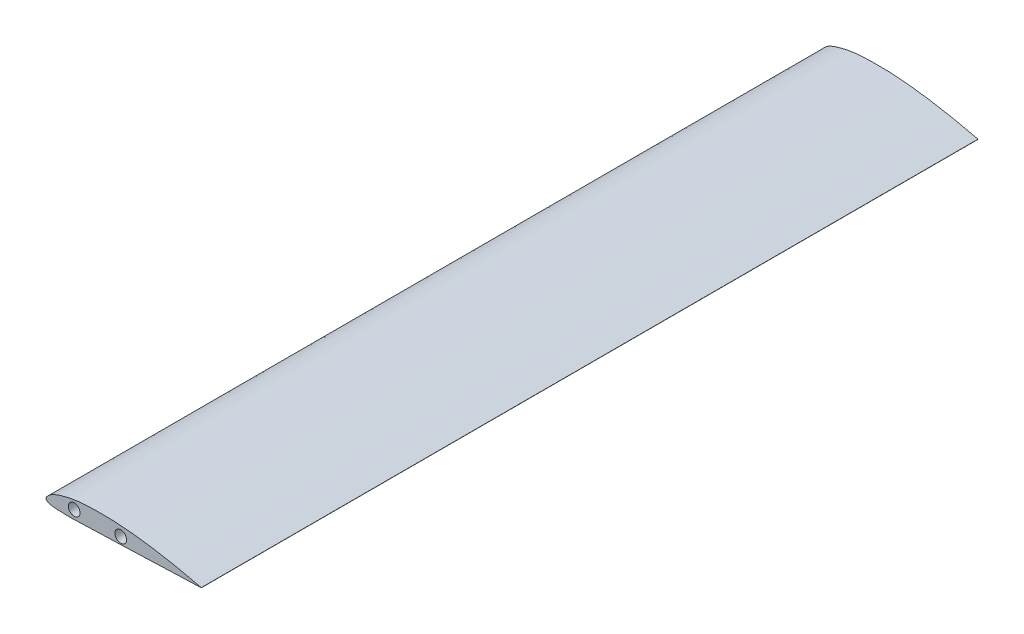
from build123d import *

# Parameters (mm, degrees)
BOSS_EXTRUDE1_DEPTH = 254
SKETCH2_R           = 1.905
CUT_EXTRUDE1_DEPTH  = 12.7


with BuildPart() as part:
    # Sketch1 → Boss-Extrude1 (new body)
    with BuildSketch(Plane.XY):
        with BuildLine():
            Line((50.8, 0.0304292), (50.8, -0.0304292))
            add(Edge.make_bspline(
                [(50.8, 0.0304292), (50.63067102, 0.070579584), (50.29203583, 0.150874953), (49.784053923, 0.270975499), (49.276103861, 0.3906376), (48.598975978, 0.548855774), (47.752607871, 0.743726876), (46.736570106, 0.971867714), (45.720515706, 1.194603662), (44.70452705, 1.412442044), (43.688526366, 1.625048045), (42.672544186, 1.83238449), (41.656522264, 2.034024033), (40.640545517, 2.23021224), (39.624516645, 2.420357812), (38.608526857, 2.604792252), (37.59249485, 2.783050048), (36.576495895, 2.955471006), (35.560483387, 3.121740236), (34.544495834, 3.281876565), (33.528530885, 3.435493939), (32.512531352, 3.581686893), (31.496553083, 3.720222443), (30.480541121, 3.850178133), (29.126506483, 4.011498541), (27.771719898, 4.154664361), (26.416397421, 4.279557315), (25.400362172, 4.364059043), (24.384339054, 4.439344114), (23.030041724, 4.526642184), (21.675232888, 4.592491037), (20.320155782, 4.633691392), (19.30406966, 4.651334264), (18.287997053, 4.656566857), (17.271942664, 4.650307427), (16.255901326, 4.633837814), (15.239876724, 4.607821863), (14.223762431, 4.574113992), (13.207547014, 4.528270701), (12.191199646, 4.465450912), (11.17469825, 4.38044787), (10.157997005, 4.268357118), (9.141444229, 4.123426341), (8.125037117, 3.945345186), (7.108348174, 3.735375641), (6.091035966, 3.491394576), (5.07322112, 3.206513965), (4.05555575, 2.871950094), (3.208501887, 2.55234561), (2.533415643, 2.251664373), (2.021814974, 1.989758164), (1.505610587, 1.678572801), (1.029061746, 1.315449955), (0.671173287, 0.970843301), (0.397988148, 0.693865537), (0.224504552, 0.491374229), (0.110424089, 0.317101829), (0.05462197, 0.202939449), (0.018976012, 0.104583867), (-0.013292311, -0.037523946), (0.003121477, -0.18539933), (0.054578612, -0.314116806), (0.109862255, -0.41647484), (0.222129251, -0.56568907), (0.393319806, -0.723830258), (0.660323781, -0.904551123), (1.039214509, -1.050937114), (1.522549872, -1.148317492), (2.030189933, -1.249261735), (2.538556158, -1.326845098), (3.215971307, -1.398672831), (4.063574062, -1.447382771), (5.07964625, -1.495649751), (6.09584327, -1.524658827), (7.111951661, -1.538414328), (8.128029402, -1.538832774), (9.144067551, -1.527977449), (10.498852085, -1.501587878), (11.8534935, -1.461324533), (13.20804034, -1.413414637), (14.22401573, -1.375300098), (15.23998867, -1.336317497), (16.255986169, -1.298109955), (17.271994177, -1.26071418), (18.287994793, -1.22356128), (19.304001357, -1.186759222), (20.320002845, -1.149834522), (21.336002667, -1.112745329), (22.352003187, -1.07552275), (23.367999482, -1.038083922), (24.38400137, -1.000729471), (25.399998775, -0.963253257), (26.415999174, -0.925875262), (27.431998934, -0.888530703), (29.125333833, -0.826411065), (30.818666122, -0.764237314), (32.8506686, -0.689696522), (34.205330874, -0.63982676), (35.560001489, -0.590167225), (36.575998464, -0.552780717), (37.592001548, -0.51554362), (38.607998449, -0.47815509), (39.624001552, -0.440918534), (40.639998447, -0.403529859), (41.656001553, -0.366293343), (42.671998447, -0.328904656), (43.688001553, -0.291668146), (44.703998447, -0.254279447), (45.720001554, -0.217042982), (46.735998442, -0.179654113), (47.752001572, -0.14241828), (48.598665677, -0.11125892), (49.276000101, -0.086413539), (49.783999849, -0.067763088), (50.292001125, -0.049137288), (50.630666835, -0.036665237), (50.8, -0.0304292)],
                knots=[0, 0, 0, 0, 0.005027835, 0.010054994, 0.01508103, 0.020105055, 0.030145261, 0.040173646, 0.050190794, 0.06019768, 0.070194226, 0.080180377, 0.09015591, 0.100121106, 0.110075703, 0.120020101, 0.129954271, 0.139878706, 0.149793491, 0.159698811, 0.169594433, 0.179479778, 0.189354744, 0.199219015, 0.209072795, 0.228751158, 0.238577242, 0.248395636, 0.258207018, 0.268011852, 0.287604023, 0.297393127, 0.307179253, 0.316964018, 0.326748819, 0.336534715, 0.346322474, 0.356112722, 0.365907652, 0.375711463, 0.385530879, 0.395375762, 0.405259305, 0.415192461, 0.425184025, 0.435248335, 0.445412191, 0.455710779, 0.466190959, 0.471552192, 0.477054504, 0.482786727, 0.488945835, 0.494316033, 0.497126416, 0.500187368, 0.502000869, 0.503128202, 0.503849971, 0.505020137, 0.507317905, 0.507986558, 0.509023586, 0.510668219, 0.513358348, 0.515715812, 0.519949385, 0.524973188, 0.5299544, 0.534903202, 0.539824123, 0.549630394, 0.559425369, 0.569214167, 0.578999733, 0.588784364, 0.598569511, 0.608355933, 0.627933315, 0.637723968, 0.6475154, 0.657307127, 0.667098669, 0.676889956, 0.686681117, 0.69647219, 0.70626328, 0.716054423, 0.72584562, 0.735636871, 0.745428122, 0.755219391, 0.765010642, 0.774801875, 0.78459309, 0.813966735, 0.82375795, 0.843340416, 0.853131631, 0.862922864, 0.872714079, 0.882505312, 0.892296527, 0.90208776, 0.911878975, 0.921670208, 0.931461423, 0.941252656, 0.951043871, 0.960835104, 0.970626319, 0.980417552, 0.98531316, 0.990208767, 0.995104375, 1, 1, 1, 1], degree=3))
        make_face()
    extrude(amount=BOSS_EXTRUDE1_DEPTH)

    # Sketch2 → Cut-Extrude1 (cut)
    with BuildSketch(Plane.XY.offset(254)):
        with Locations((9.220284709, 1.335439633)):
            Circle(SKETCH2_R)
        with Locations((24.460284709, 1.335439633)):
            Circle(SKETCH2_R)
    extrude(amount=-CUT_EXTRUDE1_DEPTH, mode=Mode.SUBTRACT)


solid = part.part
